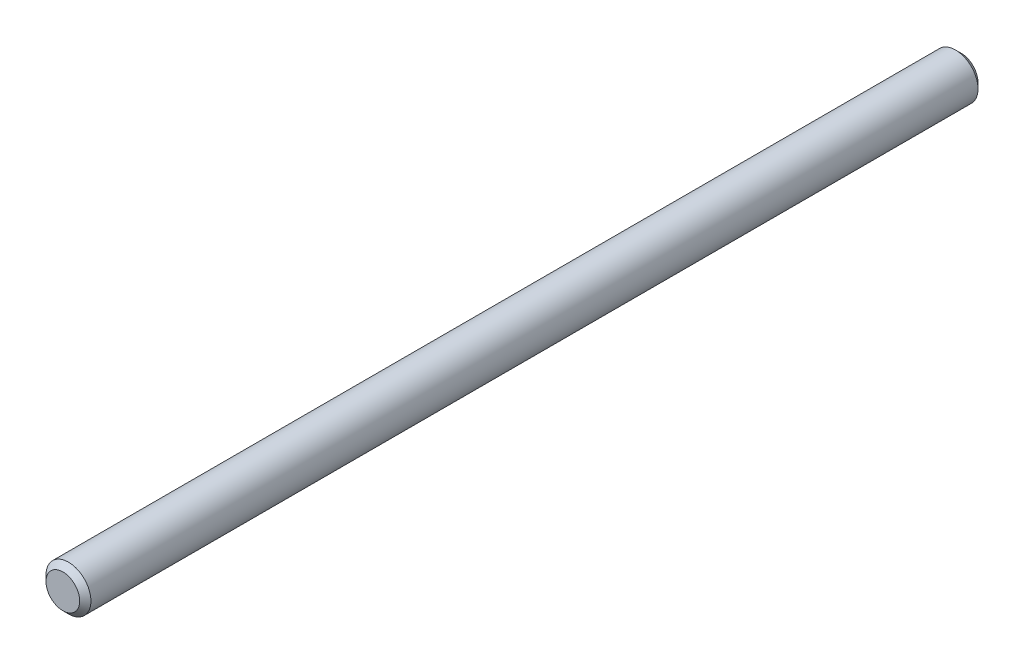
from build123d import *

# Parameters (mm, degrees)
SKETCH1_R           = 4
BOSS_EXTRUDE1_DEPTH = 160
CHAMFER1_SIZE       = 1


with BuildPart() as part:
    # Sketch1 → Boss-Extrude1 (new body)
    with BuildSketch(Plane.XY):
        Circle(SKETCH1_R)
    extrude(amount=BOSS_EXTRUDE1_DEPTH)

    # Chamfer1
    chamfer1_edges = [part.edges().sort_by_distance(p)[0] for p in [
        (-4, 0, 0),
        (-4, 0, 160),
    ]]
    chamfer(chamfer1_edges, length=CHAMFER1_SIZE)


solid = part.part
